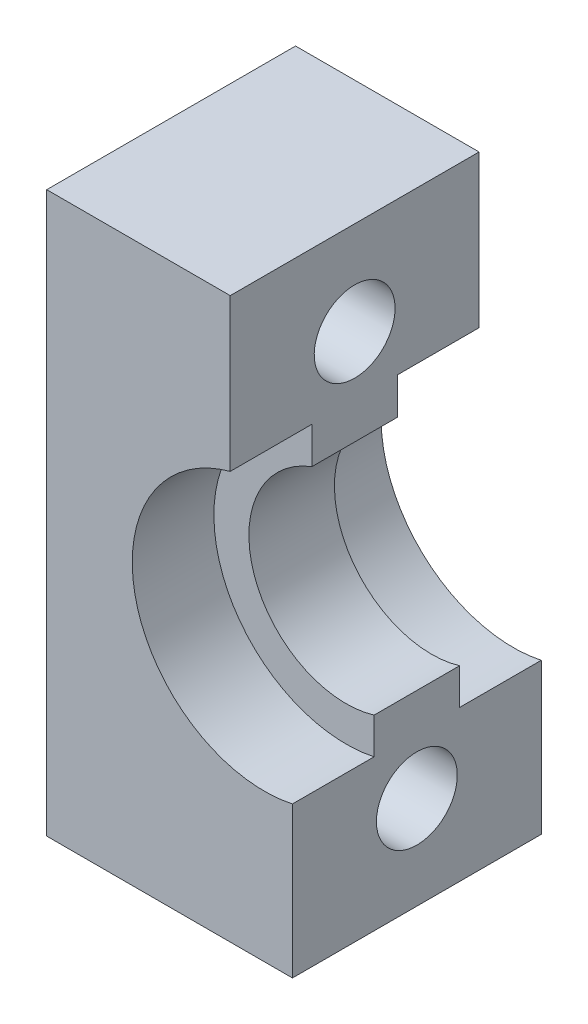
from build123d import *

# Parameters (mm, degrees)
BOSS_EXTRUDE2_DEPTH = 8
BOSS_EXTRUDE3_DEPTH = 2.75
CUT_EXTRUDE1_REACH  = 27.252
SKETCH5_R           = 2.6


with BuildPart() as part:
    # Sketch3 → Boss-Extrude2 (new, symmetric)
    with BuildSketch(Plane.XY):
        with BuildLine():
            Line((0, -18), (0, 18))
            Line((0, 18), (11.8, 18))
            Line((11.8, 18), (11.8, 8.21035931))
            ThreePointArc((11.8, 8.21035931), (5.738786153, -2.000586358), (15.8, -8.30722577))
            Line((15.8, -8.30722577), (15.8, -18))
            Line((15.8, -18), (0, -18))
        make_face()
    extrude(amount=BOSS_EXTRUDE2_DEPTH, both=True)

    # Sketch4 → Boss-Extrude3 (add, symmetric)
    with BuildSketch(Plane.XY):
        with BuildLine():
            Line((11.8, 8.21035931), (11.8, 5.85))
            ThreePointArc((11.8, 5.85), (8.079026185, -2.001141946), (15.8, -5.985190055))
            Line((15.8, -5.985190055), (15.8, -8.30722577))
            ThreePointArc((15.8, -8.30722577), (5.738786153, -2.000586358), (11.8, 8.21035931))
        make_face()
    extrude(amount=BOSS_EXTRUDE3_DEPTH, both=True)

    # Sketch5 → Cut-Extrude1 (cut, up to next)
    with BuildSketch(Plane(origin=(0, 0, 0), x_dir=(0, 0, -1), z_dir=(1, 0, 0)), mode=Mode.PRIVATE) as cut_extrude1_sk1:
        with Locations(Location((0, 12, 0), (0, 0, 270))):
            Circle(SKETCH5_R)
    cut_extrude1_tool1 = extrude(cut_extrude1_sk1.sketch, amount=CUT_EXTRUDE1_REACH, mode=Mode.PRIVATE) & part.part
    # Sketch5 → Cut-Extrude1 (cut, up to next)
    with BuildSketch(Plane(origin=(0, 0, 0), x_dir=(0, 0, -1), z_dir=(1, 0, 0)), mode=Mode.PRIVATE) as cut_extrude1_sk2:
        with Locations(Location((0, -12, 0), (0, 0, 180))):
            Circle(SKETCH5_R)
    cut_extrude1_tool2 = extrude(cut_extrude1_sk2.sketch, amount=CUT_EXTRUDE1_REACH, mode=Mode.PRIVATE) & part.part
    add(cut_extrude1_tool1.solids().sort_by_distance((0, 12, 0))[0], mode=Mode.SUBTRACT)
    add(cut_extrude1_tool2.solids().sort_by_distance((0, -12, 0))[0], mode=Mode.SUBTRACT)


solid = part.part
